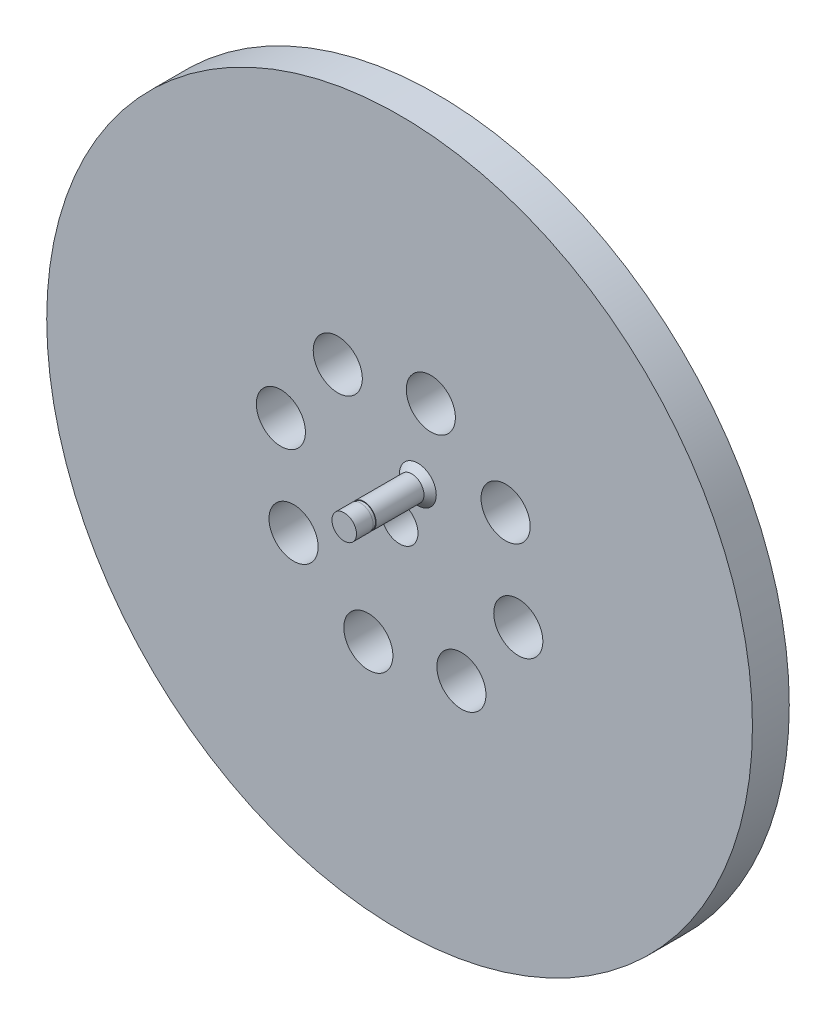
from build123d import *

# Parameters (mm, degrees)
SKETCH_1_R          = 57.5
SKETCH_1_R_2        = 3
EXTRUDE_1_DEPTH     = 6
SKETCH_3_R          = 4
CUT_EXTRUDE_2_DEPTH = 82.538334543
SKETCH_4_R          = 2
EXTRUDE_2_DEPTH     = 12
CUT_EXTRUDE_START   = -3.2
SKETCH_6_R          = 2
SKETCH_6_R_2        = 1.9
CUT_EXTRUDE_3_DEPTH = 0.5
CHAMFER_1_SIZE      = 1


with BuildPart() as part:
    # 草图1 → 凸台-拉伸1 (new body)
    with BuildSketch(Plane.XY):
        Circle(SKETCH_1_R)
        Circle(SKETCH_1_R_2, mode=Mode.SUBTRACT)
    extrude(amount=EXTRUDE_1_DEPTH)

    # 草图3 → 切除-拉伸2 (cut, through all)
    with BuildSketch(Plane(origin=(0, 0, 0), x_dir=(-1, 0, 0), z_dir=(0, 0, -1))):
        with Locations((-5.091227954, 19.341132281)):
            Circle(SKETCH_3_R)
        with Locations((10.076203981, 17.276287603)):
            Circle(SKETCH_3_R)
        with Locations((19.341132281, 5.091227954)):
            Circle(SKETCH_3_R)
        with Locations((17.276287603, -10.076203981)):
            Circle(SKETCH_3_R)
        with Locations((5.091227954, -19.341132281)):
            Circle(SKETCH_3_R)
        with Locations((-10.076203981, -17.276287603)):
            Circle(SKETCH_3_R)
        with Locations((-19.341132281, -5.091227954)):
            Circle(SKETCH_3_R)
        with Locations((-17.276287603, 10.076203981)):
            Circle(SKETCH_3_R)
    extrude(amount=-CUT_EXTRUDE_2_DEPTH, mode=Mode.SUBTRACT)

    # 草图4 → 凸台-拉伸2 (add)
    with BuildSketch(Plane.XY.offset(6)):
        with Locations((2.976659474, 6.884003078)):
            Circle(SKETCH_4_R)
    extrude(amount=EXTRUDE_2_DEPTH)

    # 草图6 → 切除-拉伸3 (cut)
    with BuildSketch(Plane.XY.offset(18).offset(CUT_EXTRUDE_START)):
        with Locations((2.976659474, 6.884003078)):
            Circle(SKETCH_6_R)
        with Locations((2.976659474, 6.884003078)):
            Circle(SKETCH_6_R_2, mode=Mode.SUBTRACT)
    extrude(amount=CUT_EXTRUDE_3_DEPTH, mode=Mode.SUBTRACT)

    # 倒角1
    chamfer_1_edges = [part.edges().sort_by_distance(p)[0] for p in [
        (0.976659474, 6.884003078, 6),
    ]]
    chamfer(chamfer_1_edges, length=CHAMFER_1_SIZE)


solid = part.part
